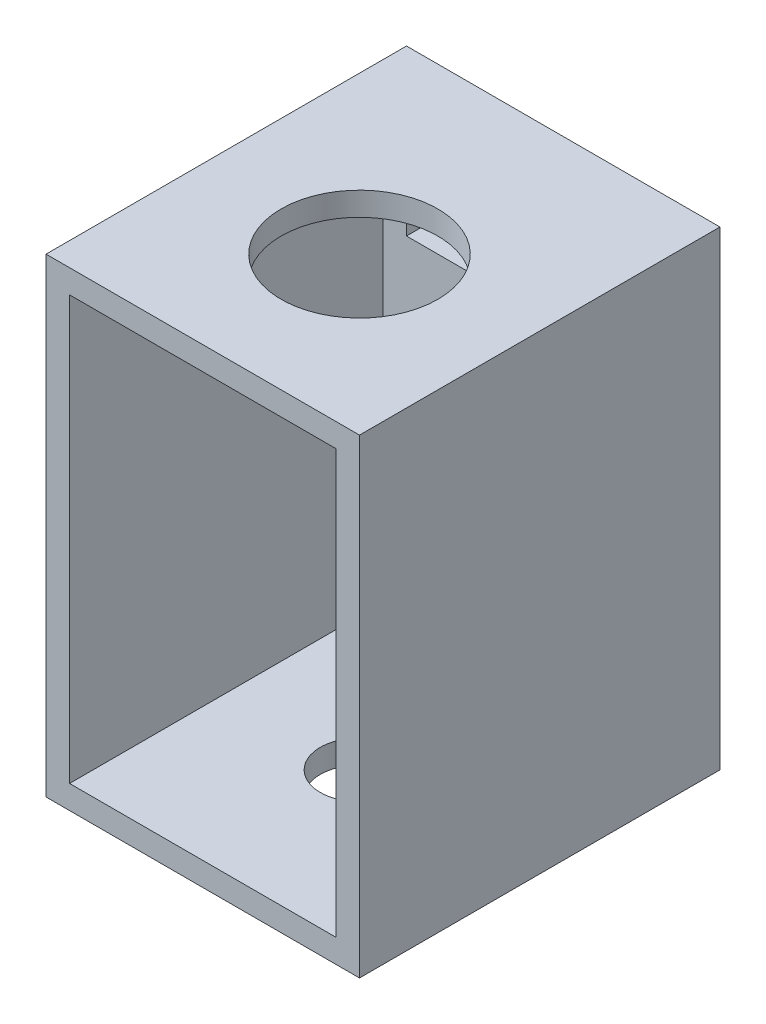
from build123d import *

# Parameters (mm, degrees)
SKETCH1_W           = 20
SKETCH1_H           = 30
SKETCH1_W_2         = 8
SKETCH1_H_2         = 4.5
SKETCH1_R           = 1.75
SKETCH1_R_2         = 2.25
SKETCH1_R_3         = 7
BOSS_EXTRUDE1_DEPTH = 3
SKETCH1_3_W         = 20
SKETCH1_3_H         = 30
SKETCH1_3_W_2       = 17
SKETCH1_3_H_2       = 27
BOSS_EXTRUDE2_DEPTH = 20
SKETCH2_R           = 2.5
CUT_EXTRUDE1_DEPTH  = 42.231056256
CUT_EXTRUDE2_START  = -28.5
SKETCH2_3_R         = 5
SKETCH2_3_R_2       = 2.5
CUT_EXTRUDE2_DEPTH  = 13.731056256


with BuildPart() as part:
    # Sketch1 → Boss-Extrude1 (new body)
    with BuildSketch(Plane.XY):
        with Locations((10, 35)):
            Rectangle(SKETCH1_W, SKETCH1_H)
        with Locations((7, 44.75)):
            Rectangle(SKETCH1_W_2, SKETCH1_H_2, mode=Mode.SUBTRACT)
        with Locations((15.25, 25)):
            Circle(SKETCH1_R, mode=Mode.SUBTRACT)
        with Locations((14.75, 44.75)):
            Circle(SKETCH1_R_2, mode=Mode.SUBTRACT)
        with Locations((10, 35)):
            Circle(SKETCH1_R_3, mode=Mode.SUBTRACT)
    extrude(amount=-BOSS_EXTRUDE1_DEPTH)

    # Sketch1<3> → Boss-Extrude2 (add)
    with BuildSketch(Plane.XY):
        with Locations((10, 35)):
            Rectangle(SKETCH1_3_W, SKETCH1_3_H)
        with Locations((10, 35)):
            Rectangle(SKETCH1_3_W_2, SKETCH1_3_H_2, mode=Mode.SUBTRACT)
    extrude(amount=BOSS_EXTRUDE2_DEPTH)

    # Sketch2 → Cut-Extrude1 (cut, through all)
    with BuildSketch(Plane.XZ.offset(-20)):
        with Locations((10, 10)):
            Circle(SKETCH2_R)
    extrude(amount=-CUT_EXTRUDE1_DEPTH, mode=Mode.SUBTRACT)

    # Sketch2<3> → Cut-Extrude2 (cut, through all)
    with BuildSketch(Plane.XZ.offset(-20).offset(CUT_EXTRUDE2_START)):
        with Locations((10, 10)):
            Circle(SKETCH2_3_R)
        with Locations((10, 10)):
            Circle(SKETCH2_3_R_2, mode=Mode.SUBTRACT)
    extrude(amount=-CUT_EXTRUDE2_DEPTH, mode=Mode.SUBTRACT)


solid = part.part
